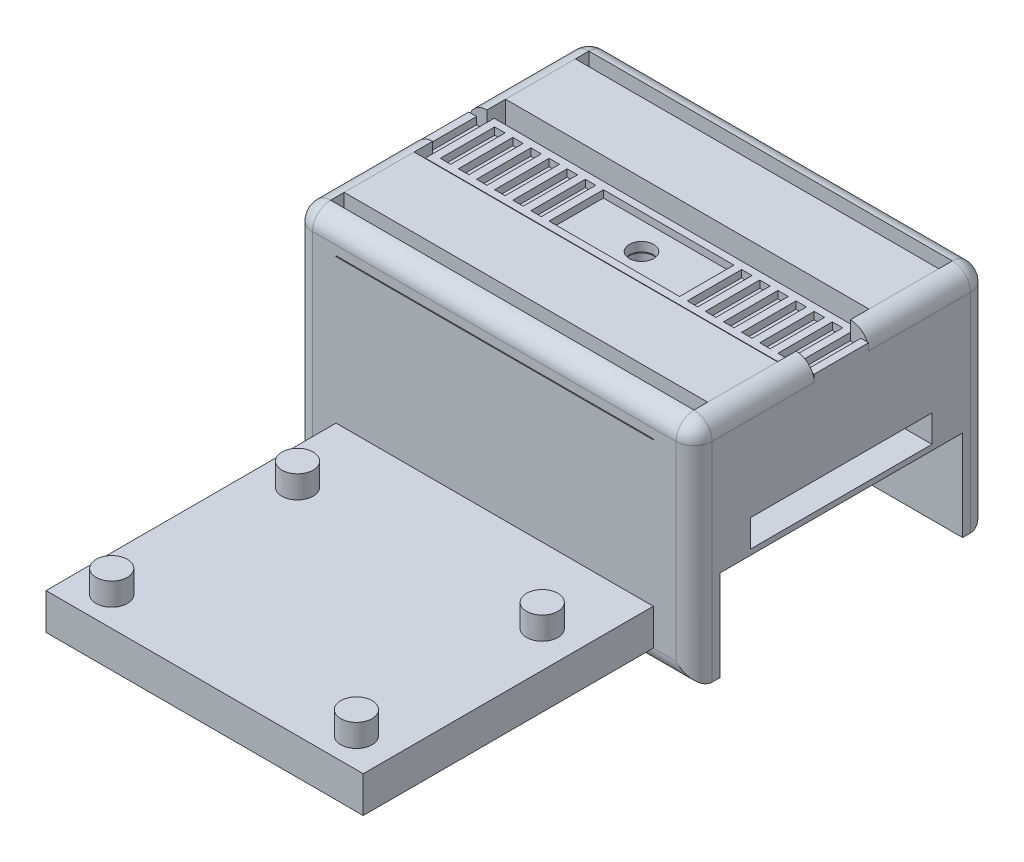
from build123d import *

# Parameters (mm, degrees)
SKETCH1_W               = 44.1
SKETCH1_H               = 32.5
BOSS_EXTRUDE1_DEPTH     = 25
SKETCH2_W               = 44.1
SKETCH2_H               = 26.75
CUT_EXTRUDE1_DEPTH      = 10
FILLET1_R               = 2
CUT_EXTRUDE2_DEPTH      = 38.084565523
CUT_EXTRUDE2_DEPTH_BACK = 38.084565523
SKETCH6_W               = 20
SKETCH6_H               = 3
SKETCH6_W_2             = 6
SKETCH6_H_2             = 2
SKETCH7_W               = 40.1
SKETCH7_H               = 1.25
CUT_EXTRUDE3_DEPTH      = 5.5
SKETCH8_W               = 0.85
SKETCH8_H               = 6
BOSS_EXTRUDE3_DEPTH     = 0.8
SKETCH9_R               = 1.35
CUT_EXTRUDE4_DEPTH      = 4
SKETCH11_W              = 40.1
SKETCH11_H              = 1.2
CUT_EXTRUDE5_DEPTH      = 0.8
SKETCH12_W              = 40.1
SKETCH12_H              = 1.2
CUT_EXTRUDE6_DEPTH      = 0.8
SKETCH13_W              = 35
SKETCH13_H              = 0.1
CUT_EXTRUDE8_DEPTH      = 47.555907251
SKETCH14_W              = 35
SKETCH14_H              = 4
BOSS_EXTRUDE4_DEPTH     = 32
SKETCH15_R              = 1.725
BOSS_EXTRUDE5_DEPTH     = 2.5
SKETCH16_W              = 40.1
SKETCH16_H              = 1.5
CUT_EXTRUDE9_DEPTH      = 5


with BuildPart() as part:
    # Sketch1 → Boss-Extrude1 (new body)
    with BuildSketch(Plane(origin=(0, 0, 0), x_dir=(1, 0, 0), z_dir=(0, 1, 0))):
        Rectangle(SKETCH1_W, SKETCH1_H)
    extrude(amount=BOSS_EXTRUDE1_DEPTH)

    # Sketch2 → Cut-Extrude1 (cut)
    with BuildSketch(Plane.XZ):
        Rectangle(SKETCH2_W, SKETCH2_H)
    extrude(amount=-CUT_EXTRUDE1_DEPTH, mode=Mode.SUBTRACT)

    # Fillet1
    fillet1_edges = [part.edges().sort_by_distance(p)[0] for p in [
        (-22.05, 25, 0),
        (0, 25, 16.25),
        (22.05, 25, 0),
        (0, 0, 16.25),
        (0, 0, -16.25),
        (22.05, 12.5, 16.25),
        (-22.05, 12.5, 16.25),
        (-22.05, 12.5, -16.25),
        (22.05, 12.5, -16.25),
        (0, 25, -16.25),
    ]]
    fillet(fillet1_edges, radius=FILLET1_R)

    # Sketch6 → Cut-Extrude2 (cut, two sides: drawn at the far end of the back side and taken through both)
    with BuildSketch(Plane(origin=(0, 0, 0), x_dir=(0, 0, -1), z_dir=(1, 0, 0)).offset(-CUT_EXTRUDE2_DEPTH_BACK)):
        with Locations((0, 12.1)):
            Rectangle(SKETCH6_W, SKETCH6_H)
        with Locations((0, 24)):
            Rectangle(SKETCH6_W_2, SKETCH6_H_2)
    extrude(amount=CUT_EXTRUDE2_DEPTH + CUT_EXTRUDE2_DEPTH_BACK, mode=Mode.SUBTRACT)

    # Sketch7 → Cut-Extrude3 (cut)
    with BuildSketch(Plane(origin=(0, 25, 0), x_dir=(1, 0, 0), z_dir=(0, 1, 0))):
        with Locations((0, 4.425)):
            Rectangle(SKETCH7_W, SKETCH7_H)
        with Locations((0, -4.425)):
            Rectangle(SKETCH7_W, SKETCH7_H)
    extrude(amount=-CUT_EXTRUDE3_DEPTH, mode=Mode.SUBTRACT)

    # Sketch8 → Boss-Extrude3 (add)
    with BuildSketch(Plane(origin=(0, 23, 0), x_dir=(1, 0, 0), z_dir=(0, 1, 0))):
        with Locations((-21.625, 0)):
            Rectangle(SKETCH8_W, SKETCH8_H)
        with Locations((21.625, 0)):
            Rectangle(SKETCH8_W, SKETCH8_H)
        with Locations((-19.625, 0)):
            Rectangle(SKETCH8_W, SKETCH8_H)
        with Locations((19.625, 0)):
            Rectangle(SKETCH8_W, SKETCH8_H)
        with Locations((-17.625, 0)):
            Rectangle(SKETCH8_W, SKETCH8_H)
        with Locations((17.625, 0)):
            Rectangle(SKETCH8_W, SKETCH8_H)
        with Locations((15.625, 0)):
            Rectangle(SKETCH8_W, SKETCH8_H)
        with Locations((-15.625, 0)):
            Rectangle(SKETCH8_W, SKETCH8_H)
        with Locations((13.625, 0)):
            Rectangle(SKETCH8_W, SKETCH8_H)
        with Locations((-13.625, 0)):
            Rectangle(SKETCH8_W, SKETCH8_H)
        with Locations((11.625, 0)):
            Rectangle(SKETCH8_W, SKETCH8_H)
        with Locations((-11.625, 0)):
            Rectangle(SKETCH8_W, SKETCH8_H)
        with Locations((9.625, 0)):
            Rectangle(SKETCH8_W, SKETCH8_H)
        with Locations((-9.625, 0)):
            Rectangle(SKETCH8_W, SKETCH8_H)
        with Locations((7.625, 0)):
            Rectangle(SKETCH8_W, SKETCH8_H)
        with Locations((-7.625, 0)):
            Rectangle(SKETCH8_W, SKETCH8_H)
    extrude(amount=BOSS_EXTRUDE3_DEPTH)

    # Sketch9 → Cut-Extrude4 (cut)
    with BuildSketch(Plane(origin=(0, 23, 0), x_dir=(1, 0, 0), z_dir=(0, 1, 0))):
        with Locations(Location((0, 0, 0), (0, 0, 270))):
            Circle(SKETCH9_R)
    extrude(amount=-CUT_EXTRUDE4_DEPTH, mode=Mode.SUBTRACT)

    # Sketch11 → Cut-Extrude5 (cut)
    with BuildSketch(Plane(origin=(0, 0, 3), x_dir=(-1, 0, 0), z_dir=(0, 0, -1))):
        with Locations((0, 24.4)):
            Rectangle(SKETCH11_W, SKETCH11_H)
    extrude(amount=-CUT_EXTRUDE5_DEPTH, mode=Mode.SUBTRACT)

    # Sketch12 → Cut-Extrude6 (cut)
    with BuildSketch(Plane.XY.offset(-3)):
        with Locations((0, 24.4)):
            Rectangle(SKETCH12_W, SKETCH12_H)
    extrude(amount=-CUT_EXTRUDE6_DEPTH, mode=Mode.SUBTRACT)

    # Sketch13 → Cut-Extrude8 (cut, through all)
    with BuildSketch(Plane(origin=(0, 0, -16.25), x_dir=(-1, 0, 0), z_dir=(0, 0, -1))):
        with Locations((-0.05, 21.95)):
            Rectangle(SKETCH13_W, SKETCH13_H)
    extrude(amount=-CUT_EXTRUDE8_DEPTH, mode=Mode.SUBTRACT)

    # Sketch14 → Boss-Extrude4 (add)
    with BuildSketch(Plane.XY.offset(16.25)):
        with Locations((0.05, 4)):
            Rectangle(SKETCH14_W, SKETCH14_H)
    extrude(amount=BOSS_EXTRUDE4_DEPTH)

    # Sketch15 → Boss-Extrude5 (add)
    with BuildSketch(Plane(origin=(0, 6, 0), x_dir=(1, 0, 0), z_dir=(0, 1, 0))):
        with Locations(Location((-13.45, -24.5, 0), (0, 0, 90))):
            Circle(SKETCH15_R)
        with Locations(Location((13.55, -24.5, 0), (0, 0, 90))):
            Circle(SKETCH15_R)
        with Locations(Location((13.55, -45, 0), (0, 0, 90))):
            Circle(SKETCH15_R)
        with Locations(Location((-13.45, -45, 0), (0, 0, 90))):
            Circle(SKETCH15_R)
    extrude(amount=BOSS_EXTRUDE5_DEPTH)

    # Sketch16 → Cut-Extrude9 (cut)
    with BuildSketch(Plane(origin=(0, 25, 0), x_dir=(1, 0, 0), z_dir=(0, 1, 0))):
        with Locations((0, 13.5)):
            Rectangle(SKETCH16_W, SKETCH16_H)
        with Locations((0, -13.5)):
            Rectangle(SKETCH16_W, SKETCH16_H)
    extrude(amount=-CUT_EXTRUDE9_DEPTH, mode=Mode.SUBTRACT)


solid = part.part
